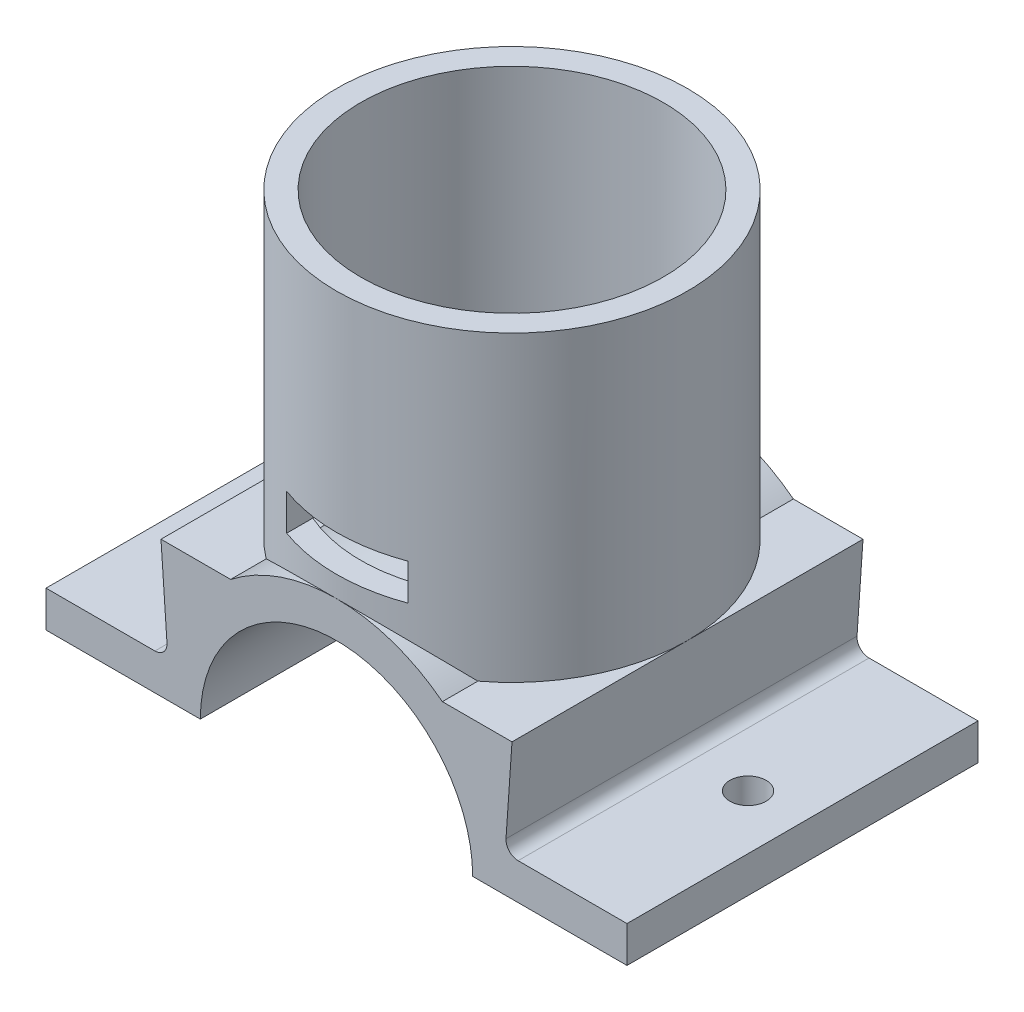
from build123d import *

# Parameters (mm, degrees)
SKETCH1_R                = 14.5
SKETCH1_R_2              = 12.5
BOSS_EXTRUDE1_DEPTH      = 25
BOSS_EXTRUDE2_DEPTH      = 14.5
BOSS_EXTRUDE2_DEPTH_BACK = 14.5
SKETCH3_R                = 5.997794038
CUT_EXTRUDE1_DEPTH       = 25
SKETCH4_W                = 10
SKETCH4_H                = 3
CUT_EXTRUDE2_DEPTH       = 30
SKETCH6_R                = 1.5
CUT_EXTRUDE4_DEPTH       = 30


with BuildPart() as part:
    # Sketch1 → Boss-Extrude1 (new body)
    with BuildSketch(Plane(origin=(0, 0, 0), x_dir=(1, 0, 0), z_dir=(0, 1, 0))):
        Circle(SKETCH1_R)
        Circle(SKETCH1_R_2, mode=Mode.SUBTRACT)
    extrude(amount=BOSS_EXTRUDE1_DEPTH)

    # Sketch2 → Boss-Extrude2 (add, two sides: drawn at the far end of the back side and taken through both)
    with BuildSketch(Plane.XY.offset(-BOSS_EXTRUDE2_DEPTH_BACK)):
        with BuildLine():
            Line((-11.25, -11.25), (-20, -11.25))
            Line((-20, -11.25), (-24, -11.25))
            Line((-24, -11.25), (-24, -8.25))
            Line((-24, -8.25), (-20, -8.25))
            Line((-20, -8.25), (-15.002024714, -8.25))
            ThreePointArc((-15.002024714, -8.25), (-14.270980746, -7.932330358), (-14.004397729, -7.181149435))
            Line((-14.004397729, -7.181149435), (-14.5, 0))
            Line((-14.5, 0), (-8.746427842, 0))
            ThreePointArc((-8.746427842, 0), (0, 3), (8.746427842, 0))
            Line((8.746427842, 0), (14.5, 0))
            Line((14.5, 0), (14.004397729, -7.181149435))
            ThreePointArc((14.004397729, -7.181149435), (14.270980746, -7.932330358), (15.002024714, -8.25))
            Line((15.002024714, -8.25), (20, -8.25))
            Line((20, -8.25), (24, -8.25))
            Line((24, -8.25), (24, -11.25))
            Line((24, -11.25), (20, -11.25))
            Line((20, -11.25), (11.25, -11.25))
            ThreePointArc((11.25, -11.25), (0, 0), (-11.25, -11.25))
        make_face()
    extrude(amount=BOSS_EXTRUDE2_DEPTH + BOSS_EXTRUDE2_DEPTH_BACK)

    # Sketch3 → Cut-Extrude1 (cut)
    with BuildSketch(Plane.XZ.offset(11.25)):
        Circle(SKETCH3_R)
    extrude(amount=-CUT_EXTRUDE1_DEPTH, mode=Mode.SUBTRACT)

    # Sketch4 → Cut-Extrude2 (cut)
    with BuildSketch(Plane(origin=(0, 0, -14.5), x_dir=(-1, 0, 0), z_dir=(0, 0, -1))):
        with Locations((0, 6.23565899)):
            Rectangle(SKETCH4_W, SKETCH4_H)
    extrude(amount=-CUT_EXTRUDE2_DEPTH, mode=Mode.SUBTRACT)

    # Sketch6 → Cut-Extrude4 (cut)
    with BuildSketch(Plane(origin=(0, -8.25, 0), x_dir=(1, 0, 0), z_dir=(0, 1, 0))):
        with Locations((-19.501012357, 0)):
            Circle(SKETCH6_R)
        with Locations((19.501012357, 0)):
            Circle(SKETCH6_R)
    extrude(amount=-CUT_EXTRUDE4_DEPTH, mode=Mode.SUBTRACT)


solid = part.part
